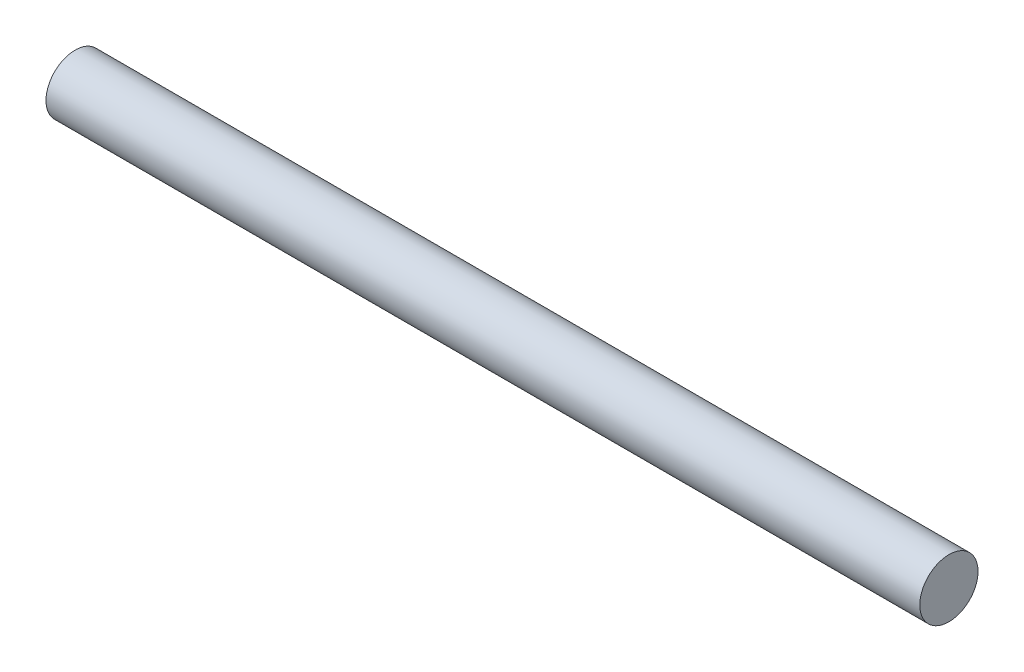
from build123d import *

# Parameters (mm, degrees)
SKETCH1_R           = 3
BOSS_EXTRUDE1_DEPTH = 90


with BuildPart() as part:
    # Sketch1 → Boss-Extrude1 (new body)
    with BuildSketch(Plane(origin=(0, 0, 0), x_dir=(0, 0, -1), z_dir=(1, 0, 0))):
        with Locations(Location((0, 0, 0), (0, 0, 180))):
            Circle(SKETCH1_R)
    extrude(amount=BOSS_EXTRUDE1_DEPTH)


solid = part.part
